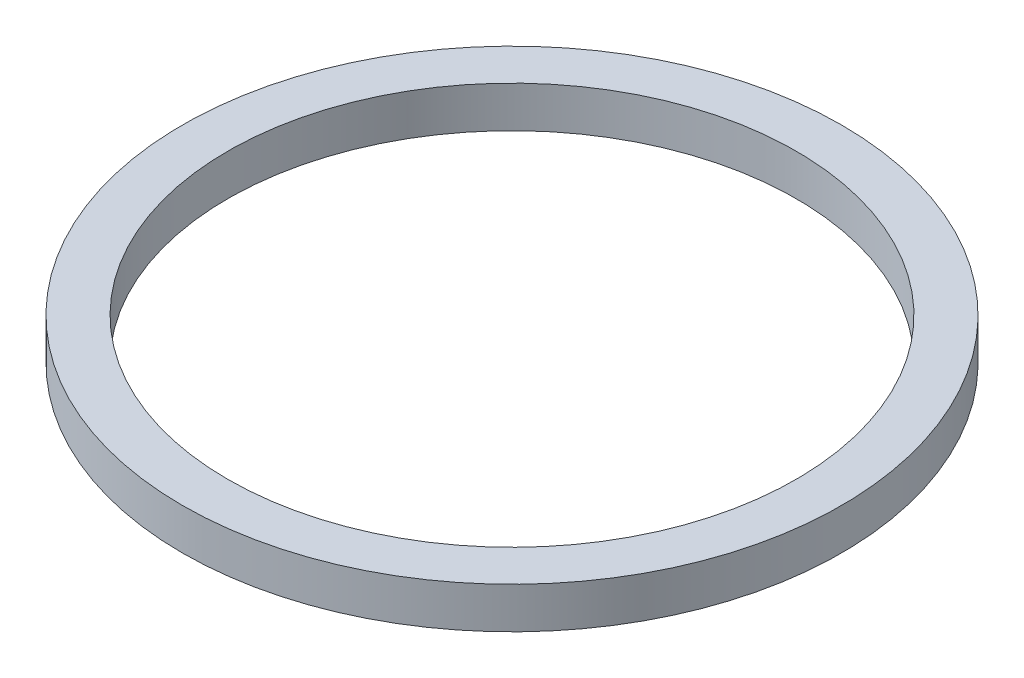
from build123d import *

# Parameters (mm, degrees)
SKETCH1_R           = 80
SKETCH1_R_2         = 69
BOSS_EXTRUDE1_DEPTH = 10


with BuildPart() as part:
    # Sketch1 → Boss-Extrude1 (new body)
    with BuildSketch(Plane(origin=(0, 0, 0), x_dir=(1, 0, 0), z_dir=(0, 1, 0))):
        with Locations(Location((0, 0, 0), (0, 0, 270))):
            Circle(SKETCH1_R)
        with Locations(Location((0, 0, 0), (0, 0, 270))):
            Circle(SKETCH1_R_2, mode=Mode.SUBTRACT)
    extrude(amount=BOSS_EXTRUDE1_DEPTH)


solid = part.part
